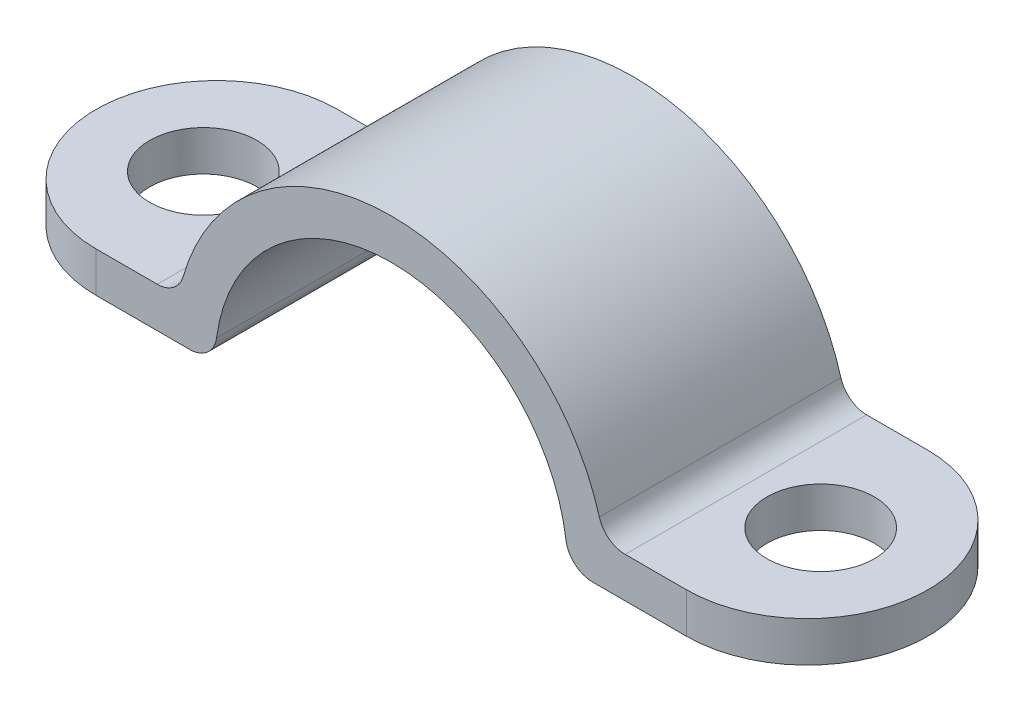
from build123d import *

# Parameters (mm, degrees)
BOSS_EXTRUDE1_DEPTH = 18
CUT_EXTRUDE1_REACH  = 40.177
SKETCH2_R           = 4
FILLET2_RADIUS      = 9
FILLET2_LENGTH      = 3
FILLET3_RADIUS      = 9
FILLET3_LENGTH      = 3


with BuildPart() as part:
    # Sketch1 → Boss-Extrude1 (new body)
    with BuildSketch(Plane.XY):
        with BuildLine():
            Line((31, 0), (15, 0))
            ThreePointArc((15, 0), (13.682550737, 0.495231765), (13.017544199, 1.73567256))
            ThreePointArc((13.017544199, 1.73567256), (0, 13.13274595), (-13.017544199, 1.73567256))
            ThreePointArc((-13.017544199, 1.73567256), (-13.682550737, 0.495231765), (-15, 0))
            Line((-15, 0), (-31, 0))
            Line((-31, 0), (-31, 3))
            Line((-31, 3), (-17.429758337, 3))
            ThreePointArc((-17.429758337, 3), (-16.226217084, 3.402662073), (-15.507296248, 4.448511548))
            ThreePointArc((-15.507296248, 4.448511548), (0, 16.13274595), (15.507296248, 4.448511548))
            ThreePointArc((15.507296248, 4.448511548), (16.226217084, 3.402662073), (17.429758337, 3))
            Line((17.429758337, 3), (31, 3))
            Line((31, 3), (31, 0))
        make_face()
    extrude(amount=BOSS_EXTRUDE1_DEPTH)

    # Sketch2 → Cut-Extrude1 (cut, up to next)
    with BuildSketch(Plane(origin=(0, 3, 0), x_dir=(1, 0, 0), z_dir=(0, 1, 0)), mode=Mode.PRIVATE) as cut_extrude1_sk1:
        with Locations(Location((-23, -9, 0), (0, 0, 180))):
            Circle(SKETCH2_R)
    cut_extrude1_tool1 = extrude(cut_extrude1_sk1.sketch, amount=-CUT_EXTRUDE1_REACH, mode=Mode.PRIVATE) & part.part
    # Sketch2 → Cut-Extrude1 (cut, up to next)
    with BuildSketch(Plane(origin=(0, 3, 0), x_dir=(1, 0, 0), z_dir=(0, 1, 0)), mode=Mode.PRIVATE) as cut_extrude1_sk2:
        with Locations(Location((23, -9, 0), (0, 0, 180))):
            Circle(SKETCH2_R)
    cut_extrude1_tool2 = extrude(cut_extrude1_sk2.sketch, amount=-CUT_EXTRUDE1_REACH, mode=Mode.PRIVATE) & part.part
    add(cut_extrude1_tool1.solids().sort_by_distance((-23, 3, 9))[0], mode=Mode.SUBTRACT)
    add(cut_extrude1_tool2.solids().sort_by_distance((23, 3, 9))[0], mode=Mode.SUBTRACT)

    # Fillet2: full round fillet: the end face becomes a half cylinder, R = half its width
    fillet2_face = Plane((-31, 1.5, 9), x_dir=(0, -1, 0), z_dir=(-1, 0, 0))  # on the end face: x along it, z out of the body
    fillet2_slab = fillet2_face.offset(-FILLET2_RADIUS / 2) * Box(FILLET2_LENGTH, 2 * FILLET2_RADIUS, FILLET2_RADIUS, mode=Mode.PRIVATE)  # the body's end, R deep
    fillet2_round = Plane((-22, 1.5, 9), x_dir=(-1, 0, 0), z_dir=(0, -1, 0)) * Cylinder(FILLET2_RADIUS, FILLET2_LENGTH, mode=Mode.PRIVATE)  # its axis R under the face
    add(fillet2_slab - fillet2_round, mode=Mode.SUBTRACT)

    # Fillet3: full round fillet: the end face becomes a half cylinder, R = half its width
    fillet3_face = Plane((31, 1.5, 9), x_dir=(0, 1, 0), z_dir=(1, 0, 0))  # on the end face: x along it, z out of the body
    fillet3_slab = fillet3_face.offset(-FILLET3_RADIUS / 2) * Box(FILLET3_LENGTH, 2 * FILLET3_RADIUS, FILLET3_RADIUS, mode=Mode.PRIVATE)  # the body's end, R deep
    fillet3_round = Plane((22, 1.5, 9), x_dir=(1, 0, 0), z_dir=(0, 1, 0)) * Cylinder(FILLET3_RADIUS, FILLET3_LENGTH, mode=Mode.PRIVATE)  # its axis R under the face
    add(fillet3_slab - fillet3_round, mode=Mode.SUBTRACT)


solid = part.part
